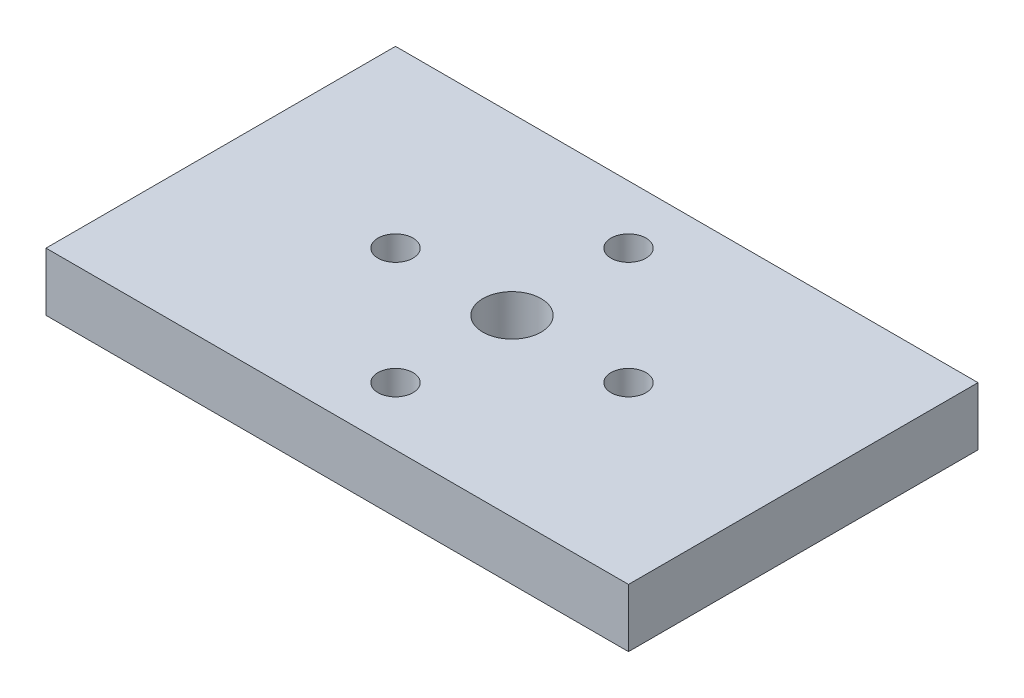
from build123d import *

# Parameters (mm, degrees)
SKETCH_1_W               = 100
SKETCH_1_H               = 60
EXTRUDE_1_DEPTH          = 10
SKETCH_2_R               = 5
CUT_EXTRUDE_1_DEPTH      = 20
SKETCH_3_R               = 3
CUT_EXTRUDE_2_DEPTH      = 20
PATTERN_CIRCULAR_1_COUNT = 4


with BuildPart() as part:
    # 草图1 → 凸台-拉伸1 (new body)
    with BuildSketch(Plane(origin=(0, 0, 0), x_dir=(1, 0, 0), z_dir=(0, 1, 0))):
        Rectangle(SKETCH_1_W, SKETCH_1_H)
    extrude(amount=EXTRUDE_1_DEPTH)

    # 草图2 → 切除-拉伸1 (cut)
    with BuildSketch(Plane(origin=(0, 0, 0), x_dir=(1, 0, 0), z_dir=(0, 1, 0))):
        with Locations(Location((0, 0, 0), (0, 0, 90))):
            Circle(SKETCH_2_R)
    extrude(amount=CUT_EXTRUDE_1_DEPTH, mode=Mode.SUBTRACT)

    # 草图3 → 切除-拉伸2 (cut)
    with BuildSketch(Plane(origin=(0, 0, 0), x_dir=(1, 0, 0), z_dir=(0, 1, 0))):
        with Locations(Location((20, 0, 0), (0, 0, 90))):
            Circle(SKETCH_3_R)
    cut_extrude_2 = extrude(amount=CUT_EXTRUDE_2_DEPTH, mode=Mode.SUBTRACT)

    # 阵列(圆周)1: 切除-拉伸2 ×4 about axis
    pattern_circular_1_axis = Axis((0, 0, 0), (0, 1, 0))
    for i in range(1, PATTERN_CIRCULAR_1_COUNT):
        add(cut_extrude_2.rotate(pattern_circular_1_axis, i * 360 / PATTERN_CIRCULAR_1_COUNT), mode=Mode.SUBTRACT)


solid = part.part
